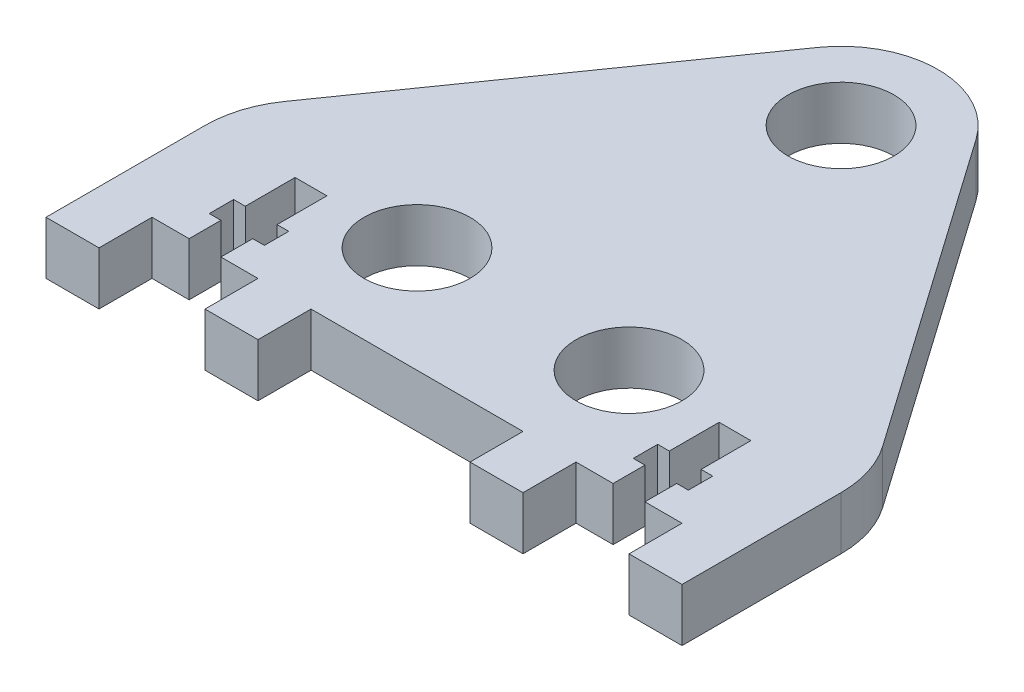
from build123d import *

# Parameters (mm, degrees)
SKETCH1_R           = 5
BOSS_EXTRUDE1_DEPTH = 5


with BuildPart() as part:
    # Sketch1 → Boss-Extrude1 (new body)
    with BuildSketch(Plane(origin=(0, 0, 0), x_dir=(1, 0, 0), z_dir=(0, 1, 0))):
        with BuildLine():
            Line((-30, 10), (-30, -5))
            Line((-30, -5), (-25, -5))
            Line((-25, -5), (-25, 0))
            Line((-25, 0), (-21.5, 0))
            Line((-21.5, 0), (-21.5, 3))
            Line((-21.5, 3), (-22.6, 3))
            Line((-22.6, 3), (-22.6, 5.3))
            Line((-22.6, 5.3), (-21.5, 5.3))
            Line((-21.5, 5.3), (-21.5, 10))
            Line((-21.5, 10), (-18.5, 10))
            Line((-18.5, 10), (-18.5, 5.3))
            Line((-18.5, 5.3), (-17.4, 5.3))
            Line((-17.4, 5.3), (-17.4, 3))
            Line((-17.4, 3), (-18.5, 3))
            Line((-18.5, 3), (-18.5, 0))
            Line((-18.5, 0), (-15, 0))
            Line((-15, 0), (-15, -5))
            Line((-15, -5), (-10, -5))
            Line((-10, -5), (-10, 0))
            Line((-10, 0), (10, 0))
            Line((10, 0), (10, -5))
            Line((10, -5), (15, -5))
            Line((15, -5), (15, 0))
            Line((15, 0), (18.5, 0))
            Line((18.5, 0), (18.5, 3))
            Line((18.5, 3), (17.4, 3))
            Line((17.4, 3), (17.4, 5.3))
            Line((17.4, 5.3), (18.5, 5.3))
            Line((18.5, 5.3), (18.5, 10))
            Line((18.5, 10), (21.5, 10))
            Line((21.5, 10), (21.5, 5.3))
            Line((21.5, 5.3), (22.6, 5.3))
            Line((22.6, 5.3), (22.6, 3))
            Line((22.6, 3), (21.5, 3))
            Line((21.5, 3), (21.5, 0))
            Line((21.5, 0), (25, 0))
            Line((25, 0), (25, -5))
            Line((25, -5), (30, -5))
            Line((30, -5), (30, 10))
            ThreePointArc((30, 10), (29.536078258, 13.01051681), (28.187357708, 15.741704779))
            Line((28.187357708, 15.741704779), (7.491105691, 45.253430824))
            ThreePointArc((7.491105691, 45.253430824), (0, 49.149601078), (-7.491105691, 45.253430824))
            Line((-7.491105691, 45.253430824), (-28.187357708, 15.741704779))
            ThreePointArc((-28.187357708, 15.741704779), (-29.536078258, 13.01051681), (-30, 10))
        make_face()
        with Locations(Location((0, 40, 0), (0, 0, 90))):
            Circle(SKETCH1_R, mode=Mode.SUBTRACT)
        with Locations(Location((-10, 10, 0), (0, 0, 270))):
            Circle(SKETCH1_R, mode=Mode.SUBTRACT)
        with Locations(Location((10, 10, 0), (0, 0, 90))):
            Circle(SKETCH1_R, mode=Mode.SUBTRACT)
    extrude(amount=BOSS_EXTRUDE1_DEPTH)


solid = part.part
